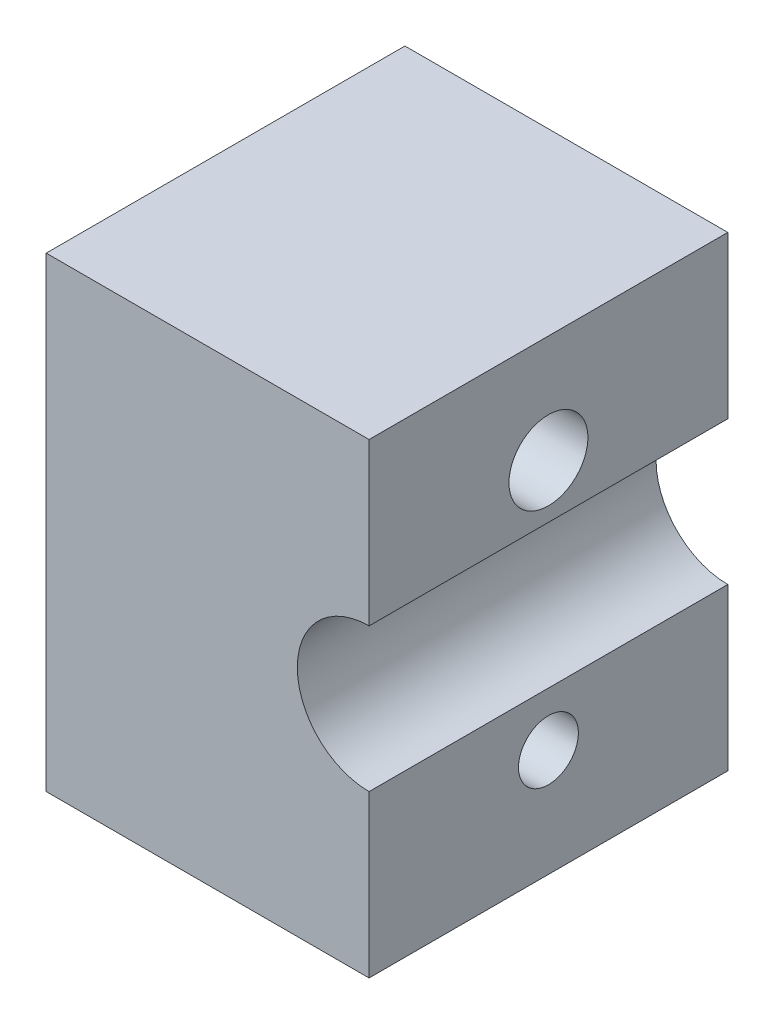
from build123d import *

# Parameters (mm, degrees)
SKETCH1_W           = 26
SKETCH1_H           = 20
BOSS_EXTRUDE1_DEPTH = 18
HOLE1_D             = 4.4
HOLE2_D             = 3.33839548
HOLE3_D             = 8


with BuildPart() as part:
    # Sketch1 → Boss-Extrude1 (new body)
    with BuildSketch(Plane(origin=(-47, 0, 0), x_dir=(0, -1, 0), z_dir=(-1, 0, 0))):
        with Locations((0, 8)):
            Rectangle(SKETCH1_W, SKETCH1_H)
    extrude(amount=-BOSS_EXTRUDE1_DEPTH)

    # Hole1 (through all)
    with Locations(Plane.ZY.offset(47)):
        with Locations((8, 7)):
            Hole(HOLE1_D / 2)

    # Hole2 (through all)
    with Locations(Plane.ZY.offset(47)):
        with Locations((8, -7)):
            Hole(HOLE2_D / 2)

    # Hole3 (through all)
    with Locations(Plane(origin=(0, 0, -2), x_dir=(-1, 0, 0), z_dir=(0, 0, -1))):
        with Locations((29, 0)):
            Hole(HOLE3_D / 2)


solid = part.part
